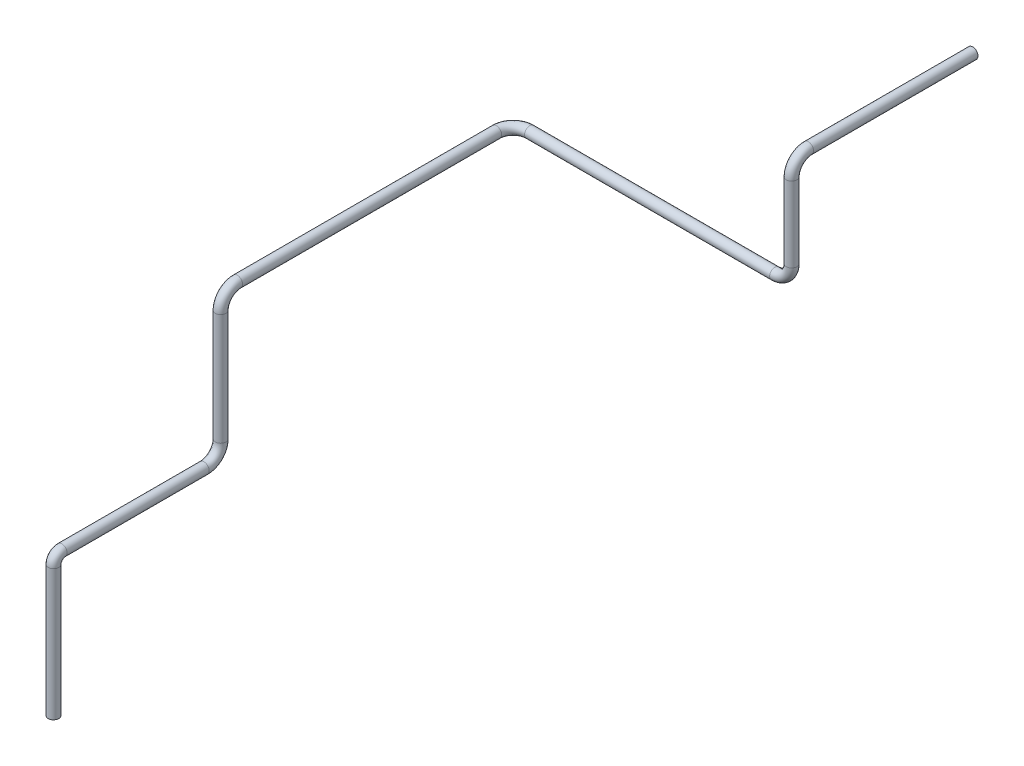
from build123d import *

# Parameters (mm, degrees)
CROQUIS1_R              = 19.05
SALIENTE_EXTRUIR1_DEPTH = 100
CROQUIS2_R              = 19.05


with BuildPart() as part:
    # Croquis1 → Saliente-Extruir1 (new body)
    with BuildSketch(Plane.XY):
        Circle(CROQUIS1_R)
    extrude(amount=SALIENTE_EXTRUIR1_DEPTH)

    # Barrer1: sweep along a curve in space
    with BuildLine() as barrer1_path:
        Line((0, 0, 100), (0, 0, 590))
        ThreePointArc((0, 0, 590), (0, -17.573593129, 632.426406871), (0, -60, 650))
        Line((0, -60, 650), (0, -330, 650))
        ThreePointArc((0, -330, 650), (-17.573593129, -372.426406871, 650), (-60, -390, 650))
        Line((-60, -390, 650), (-940, -390, 650))
        ThreePointArc((-940, -390, 650), (-982.426406871, -390, 667.573593129), (-1000, -390, 710))
        Line((-1000, -390, 710), (-1000, -390, 1640))
        ThreePointArc((-1000, -390, 1640), (-1000, -407.573593129, 1682.426406871), (-1000, -450, 1700))
        Line((-1000, -450, 1700), (-1000, -850, 1700))
        ThreePointArc((-1000, -850, 1700), (-1000, -892.426406871, 1717.573593129), (-1000, -910, 1760))
        Line((-1000, -910, 1760), (-1000, -910, 2270))
        ThreePointArc((-1000, -910, 2270), (-1000, -918.786796564, 2291.213203436), (-1000, -940, 2300))
        Line((-1000, -940, 2300), (-1000, -1410, 2300))
    # Croquis2 → Barrer1 (sweep)
    with BuildSketch(Plane.XY.offset(100)):
        Circle(CROQUIS2_R)
    sweep(path=barrer1_path.line)


solid = part.part
